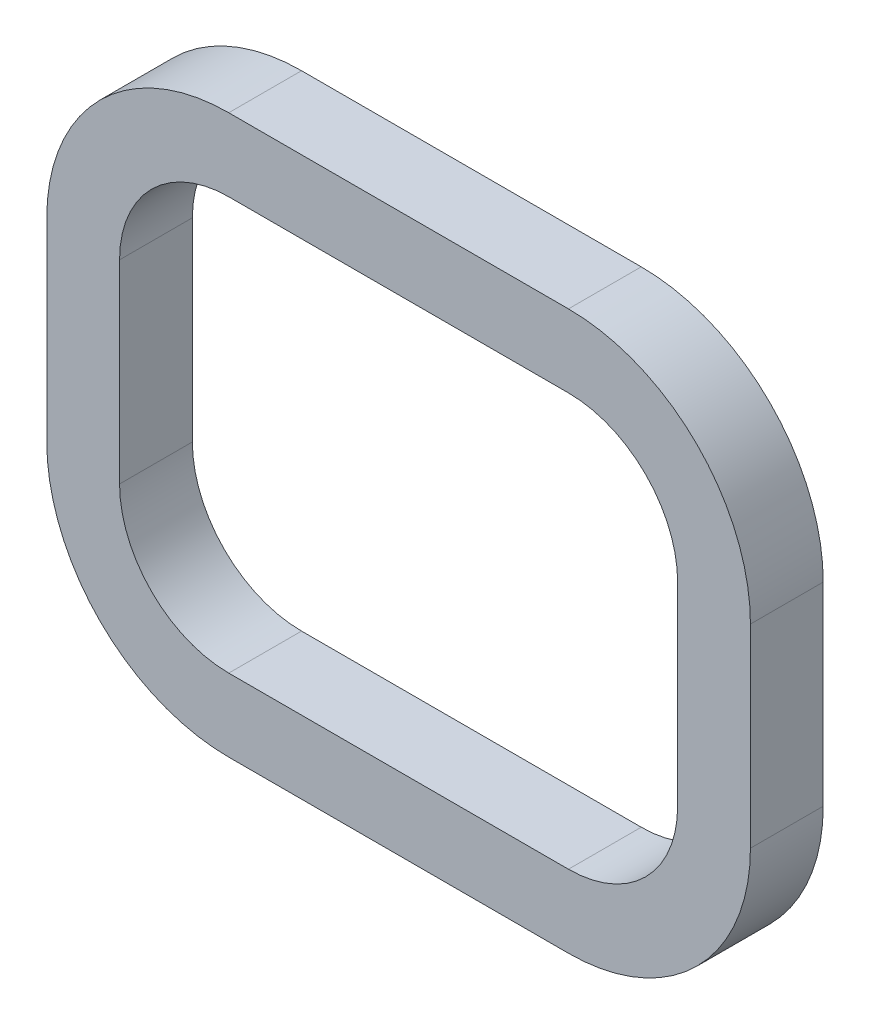
from build123d import *

# Parameters (mm, degrees)
EXTRUDE_THIN1_DEPTH = 7.5


with BuildPart() as part:
    # Sketch1 → Extrude-Thin1 (new, symmetric)
    with BuildSketch(Plane.XY):
        with BuildLine():
            Line((-35, 57.5), (35, 57.5))
            ThreePointArc((35, 57.5), (61.516504294, 46.516504294), (72.5, 20))
            Line((72.5, 20), (72.5, -20))
            ThreePointArc((72.5, -20), (61.516504294, -46.516504294), (35, -57.5))
            Line((35, -57.5), (-35, -57.5))
            ThreePointArc((-35, -57.5), (-61.516504294, -46.516504294), (-72.5, -20))
            Line((-72.5, -20), (-72.5, 20))
            ThreePointArc((-72.5, 20), (-61.516504294, 46.516504294), (-35, 57.5))
        make_face()
        with BuildLine():
            Line((-35, 42.5), (35, 42.5))
            ThreePointArc((35, 42.5), (50.909902577, 35.909902577), (57.5, 20))
            Line((57.5, 20), (57.5, -20))
            ThreePointArc((57.5, -20), (50.909902577, -35.909902577), (35, -42.5))
            Line((35, -42.5), (-35, -42.5))
            ThreePointArc((-35, -42.5), (-50.909902577, -35.909902577), (-57.5, -20))
            Line((-57.5, -20), (-57.5, 20))
            ThreePointArc((-57.5, 20), (-50.909902577, 35.909902577), (-35, 42.5))
        make_face(mode=Mode.SUBTRACT)
    extrude(amount=EXTRUDE_THIN1_DEPTH, both=True)


solid = part.part
